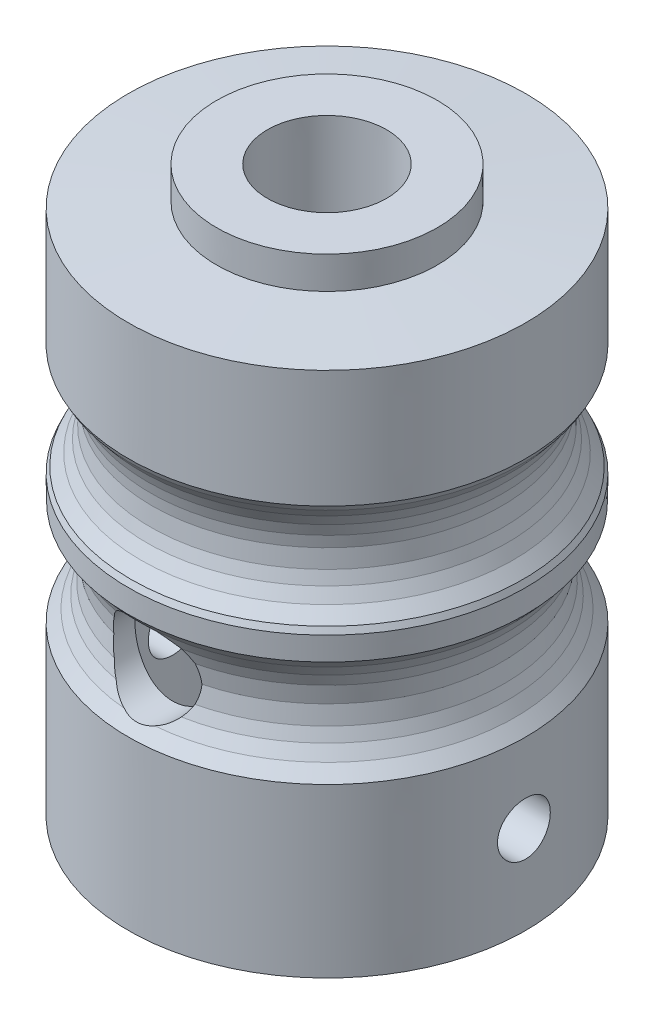
from build123d import *

# Parameters (mm, degrees)
CADVIEW_START                   = -9.527864724
CADVIEW_RADIAL_HOLE_PROFILE_1_R = 2.48285337
CADVIEW_RADIAL_HOLE_1_DEPTH     = 1.211153441
CADVIEW_START_2                 = 9.883993552
CADVIEW_RADIAL_HOLE_PROFILE_3_R = 1.487902792
CADVIEW_RADIAL_HOLE_3_DEPTH     = 1.33410702
CADVIEW_START_3                 = 9.529411148
CADVIEW_RADIAL_HOLE_PROFILE_2_R = 2.482933282
CADVIEW_RADIAL_HOLE_2_DEPTH     = 1.211645438
CADVIEW_START_4                 = -9.883175541
CADVIEW_RADIAL_HOLE_PROFILE_4_R = 1.487684902
CADVIEW_RADIAL_HOLE_4_DEPTH     = 1.33397788


with BuildPart() as part:
    # CADView Revolve Profile → CADView Core Revolve (revolve)
    with BuildSketch(Plane.XY, mode=Mode.PRIVATE) as cadview_core_revolve_sk:
        Polygon((11.191399791, 0), (11.191653126, 9.441445801), (10.600473645, 10.104003401), (10.21110818, 10.766561001), (9.973962294, 11.429118601), (9.844267199, 12.422955001), (9.96776039, 13.416791401), (10.199820897, 14.079349001), (10.58298579, 14.741906601), (11.17653503, 15.404464201), (11.191453753, 16.729579401), (11.044622402, 17.060858201), (10.490300644, 17.723415801), (10.142815737, 18.385973401), (9.936295224, 19.048531001), (9.847392508, 20.042367401), (9.928006815, 20.704925001), (10.127236671, 21.367482602), (10.464744973, 22.030040202), (11.006241128, 22.692597802), (11.19151131, 23.023876602), (11.191468831, 29.649452602), (6.217451578, 29.980731402), (6.217426324, 31.802764802), (3.357168025, 31.802764802), (3.357285746, 26.005385802), (8.704312973, 25.674107002), (8.704166835, 0), align=None)
    revolve(cadview_core_revolve_sk.sketch.rotate(Axis((0, 0, 0), (0, 1, 0)), 90), axis=Axis((0, 0, 0), (0, 1, 0)))

    # CADView Radial Hole Profile 1 → CADView Radial Hole 1 (cut, symmetric)
    with BuildSketch(Plane.XY.offset(CADVIEW_START)):
        with Locations(Location((7.8903e-05, 19.896357505, 0), (0, 0, 3.371355006))):
            Circle(CADVIEW_RADIAL_HOLE_PROFILE_1_R)
    extrude(amount=CADVIEW_RADIAL_HOLE_1_DEPTH, both=True, mode=Mode.SUBTRACT)

    # CADView Radial Hole Profile 3 → CADView Radial Hole 3 (cut, symmetric)
    with BuildSketch(Plane(origin=(0, 0, 0), x_dir=(0, 0, -1), z_dir=(1, 0, 0)).offset(CADVIEW_START_2)):
        with Locations(Location((0.000122905, 4.974426113, 0), (0, 0, 315.785142597))):
            Circle(CADVIEW_RADIAL_HOLE_PROFILE_3_R)
    extrude(amount=CADVIEW_RADIAL_HOLE_3_DEPTH, both=True, mode=Mode.SUBTRACT)

    # CADView Radial Hole Profile 2 → CADView Radial Hole 2 (cut, symmetric)
    with BuildSketch(Plane.XY.offset(CADVIEW_START_3)):
        with Locations(Location((0.000277866, 12.43536503, 0), (0, 0, 359.713626975))):
            Circle(CADVIEW_RADIAL_HOLE_PROFILE_2_R)
    extrude(amount=CADVIEW_RADIAL_HOLE_2_DEPTH, both=True, mode=Mode.SUBTRACT)

    # CADView Radial Hole Profile 4 → CADView Radial Hole 4 (cut, symmetric)
    with BuildSketch(Plane(origin=(0, 0, 0), x_dir=(0, 0, -1), z_dir=(1, 0, 0)).offset(CADVIEW_START_4)):
        with Locations(Location((2.8248e-05, 4.974003332, 0), (0, 0, 315.785395623))):
            Circle(CADVIEW_RADIAL_HOLE_PROFILE_4_R)
    extrude(amount=CADVIEW_RADIAL_HOLE_4_DEPTH, both=True, mode=Mode.SUBTRACT)


solid = part.part
